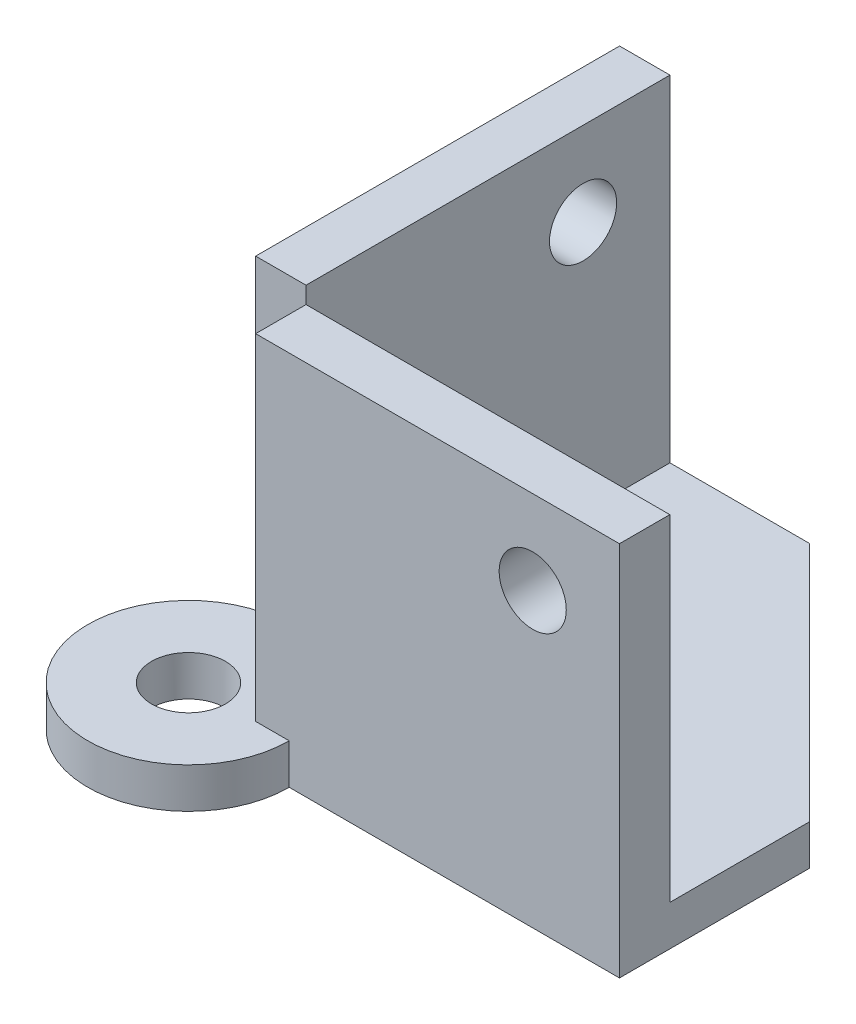
from build123d import *

# Parameters (mm, degrees)
BOSS_EXTRUDE1_DEPTH     = 5
BOSS_EXTRUDE2_DEPTH     = 15
SKETCH3_R               = 2
CUT_EXTRUDE1_DEPTH      = 34.496268449
SKETCH4_R               = 2
CUT_EXTRUDE2_DEPTH      = 34.496268449
FILLET1_R               = 1
BOSS_EXTRUDE3_DEPTH     = 2.4
BOSS_EXTRUDE4_DEPTH     = 20
CUT_EXTRUDE3_DEPTH      = 51.527220387
CUT_EXTRUDE3_DEPTH_BACK = 51.527220387
SKETCH7_R               = 2
CUT_EXTRUDE4_DEPTH      = 51.527220387
CUT_EXTRUDE4_DEPTH_BACK = 51.527220387
SKETCH8_R               = 2
CUT_EXTRUDE5_DEPTH      = 20
CUT_EXTRUDE6_DEPTH      = 32.914256521
CUT_EXTRUDE7_DEPTH      = 32.914256521
SKETCH12_R              = 6
BOSS_EXTRUDE5_DEPTH     = 2.4
CUT_EXTRUDE8_DEPTH      = 31.915717398
CUT_EXTRUDE8_DEPTH_BACK = 31.915717398
SKETCH13_R              = 2.2
SKETCH14_R              = 4
CUT_EXTRUDE9_DEPTH      = 31.915717398
CUT_EXTRUDE10_DEPTH     = 31.915717398


with BuildPart() as part:
    # Sketch1 → Boss-Extrude1 (new body)
    with BuildSketch(Plane(origin=(0, 0, 0), x_dir=(1, 0, 0), z_dir=(0, 1, 0))):
        Polygon((0, 0), (0, 19), (19, 0), align=None)
    extrude(amount=BOSS_EXTRUDE1_DEPTH)

    # Sketch2 → Boss-Extrude2 (add)
    with BuildSketch(Plane(origin=(0, 5, 0), x_dir=(1, 0, 0), z_dir=(0, 1, 0))):
        Polygon((0, 19), (0, 0), (19, 0), (16, 3), (3, 3), (3, 16), align=None)
    extrude(amount=BOSS_EXTRUDE2_DEPTH)

    # Sketch3 → Cut-Extrude1 (cut, through all)
    with BuildSketch(Plane.XY):
        with Locations((11.5, 15)):
            Circle(SKETCH3_R)
    extrude(amount=-CUT_EXTRUDE1_DEPTH, mode=Mode.SUBTRACT)

    # Sketch4 → Cut-Extrude2 (cut, through all)
    with BuildSketch(Plane.ZY):
        with Locations((-11.5, 15)):
            Circle(SKETCH4_R)
    extrude(amount=-CUT_EXTRUDE2_DEPTH, mode=Mode.SUBTRACT)

    # Fillet1
    fillet1_edges = [part.edges().sort_by_distance(p)[0] for p in [
        (9.5, 20, -3),
        (3, 20, -9.5),
        (1.5, 20, -17.5),
        (17.5, 20, -1.5),
        (19, 10, 0),
        (0, 10, -19),
    ]]
    fillet(fillet1_edges, radius=FILLET1_R)

    # Sketch5 → Boss-Extrude3 (add)
    with BuildSketch(Plane.XZ):
        Polygon((28, 9), (-9, 9), (-9, -28), align=None)
    extrude(amount=BOSS_EXTRUDE3_DEPTH)

    # Sketch6 → Boss-Extrude4 (add)
    with BuildSketch(Plane(origin=(0, 0, 0), x_dir=(1, 0, 0), z_dir=(0, 1, 0))):
        Polygon((-9, -9), (-9, 16.673246444), (-6, 16.673246444), (-6, -6), (16.666866389, -6), (16.666866389, -9), align=None)
    extrude(amount=BOSS_EXTRUDE4_DEPTH)

    # Sketch7 → Cut-Extrude3 (cut, two sides: drawn at the far end of the back side and taken through both)
    with BuildSketch(Plane.XY.offset(9).offset(-CUT_EXTRUDE3_DEPTH_BACK)):
        with Locations((11.5, 15)):
            Circle(SKETCH7_R)
    extrude(amount=CUT_EXTRUDE3_DEPTH + CUT_EXTRUDE3_DEPTH_BACK, mode=Mode.SUBTRACT)

    # Sketch8 → Cut-Extrude4 (cut, two sides: drawn at the far end of the back side and taken through both)
    with BuildSketch(Plane.ZY.offset(9).offset(-CUT_EXTRUDE4_DEPTH_BACK)):
        with Locations((-11.5, 15)):
            Circle(SKETCH8_R)
    extrude(amount=CUT_EXTRUDE4_DEPTH + CUT_EXTRUDE4_DEPTH_BACK, mode=Mode.SUBTRACT)

    # Sketch9 → Cut-Extrude5 (cut)
    with BuildSketch(Plane(origin=(0, 0, 0), x_dir=(1, 0, 0), z_dir=(0, 1, 0))):
        with BuildLine():
            Line((16.666866389, -6), (16.666866389, -9))
            Line((16.666866389, -9), (28, -9))
            Line((28, -9), (17.292893219, 1.707106781))
            ThreePointArc((17.292893219, 1.707106781), (17.524431974, 0.655116604), (16.666866389, 0.003292399))
            Line((16.666866389, 0.003292399), (16.666866389, -6))
        make_face()
        with BuildLine():
            Line((-6, 16.673246444), (0.003831968, 16.673246444))
            ThreePointArc((0.003831968, 16.673246444), (0.658123366, 17.525531279), (1.707106781, 17.292893219))
            Line((1.707106781, 17.292893219), (-9, 28))
            Line((-9, 28), (-9, 16.673246444))
            Line((-9, 16.673246444), (-6, 16.673246444))
        make_face()
    extrude(amount=-CUT_EXTRUDE5_DEPTH, mode=Mode.SUBTRACT)

    # Sketch10 → Cut-Extrude6 (cut, through all)
    with BuildSketch(Plane(origin=(0, 0, 0), x_dir=(1, 0, 0), z_dir=(0, 1, 0))):
        with BuildLine():
            Line((1.707106781, 17.292893219), (17.292893219, 1.707106781))
            ThreePointArc((17.292893219, 1.707106781), (17.50966597, 0.617316568), (16.585786438, 0))
            Line((16.585786438, 0), (0, 0))
            Line((0, 0), (0, 16.585786438))
            ThreePointArc((0, 16.585786438), (0.617316568, 17.50966597), (1.707106781, 17.292893219))
        make_face()
    extrude(amount=CUT_EXTRUDE6_DEPTH, mode=Mode.SUBTRACT)

    # Sketch11 → Cut-Extrude7 (cut, through all)
    with BuildSketch(Plane(origin=(0, 0, 0), x_dir=(1, 0, 0), z_dir=(0, 1, 0))):
        with BuildLine():
            Line((2.326753556, 16.673246444), (0.003831968, 16.673246444))
            ThreePointArc((0.003831968, 16.673246444), (0.658123366, 17.525531279), (1.707106781, 17.292893219))
            Line((1.707106781, 17.292893219), (2.326753556, 16.673246444))
        make_face()
        with BuildLine():
            Line((17.292893219, 1.707106781), (16.666866389, 2.333133611))
            Line((16.666866389, 2.333133611), (16.666866389, 0.003292399))
            ThreePointArc((16.666866389, 0.003292399), (17.524431974, 0.655116604), (17.292893219, 1.707106781))
        make_face()
    extrude(amount=-CUT_EXTRUDE7_DEPTH, mode=Mode.SUBTRACT)

    # Sketch12 → Boss-Extrude5 (add)
    with BuildSketch(Plane.XZ.offset(2.4)):
        with Locations((-9, 9)):
            Circle(SKETCH12_R)
    extrude(amount=-BOSS_EXTRUDE5_DEPTH)

    # Sketch13 → Cut-Extrude8 (cut, two sides: drawn at the far end of the back side and taken through both)
    with BuildSketch(Plane(origin=(0, 0, 0), x_dir=(1, 0, 0), z_dir=(0, 1, 0)).offset(-CUT_EXTRUDE8_DEPTH_BACK)):
        with Locations(Location((-9, -9, 0), (0, 0, 270))):
            Circle(SKETCH13_R)
    extrude(amount=CUT_EXTRUDE8_DEPTH + CUT_EXTRUDE8_DEPTH_BACK, mode=Mode.SUBTRACT)

    # Sketch14 → Cut-Extrude9 (cut, through all)
    with BuildSketch(Plane(origin=(0, 0, 0), x_dir=(1, 0, 0), z_dir=(0, 1, 0))):
        with Locations((-9, -9)):
            Circle(SKETCH14_R)
    extrude(amount=CUT_EXTRUDE9_DEPTH, mode=Mode.SUBTRACT)

    # Sketch15 → Cut-Extrude10 (cut, through all)
    with BuildSketch(Plane(origin=(0, 0, 0), x_dir=(1, 0, 0), z_dir=(0, 1, 0))):
        with BuildLine():
            Line((-9, -5), (-5, -5))
            Line((-5, -5), (-5, -9))
            ThreePointArc((-5, -9), (-6.171572875, -6.171572875), (-9, -5))
        make_face()
    extrude(amount=CUT_EXTRUDE10_DEPTH, mode=Mode.SUBTRACT)


solid = part.part
